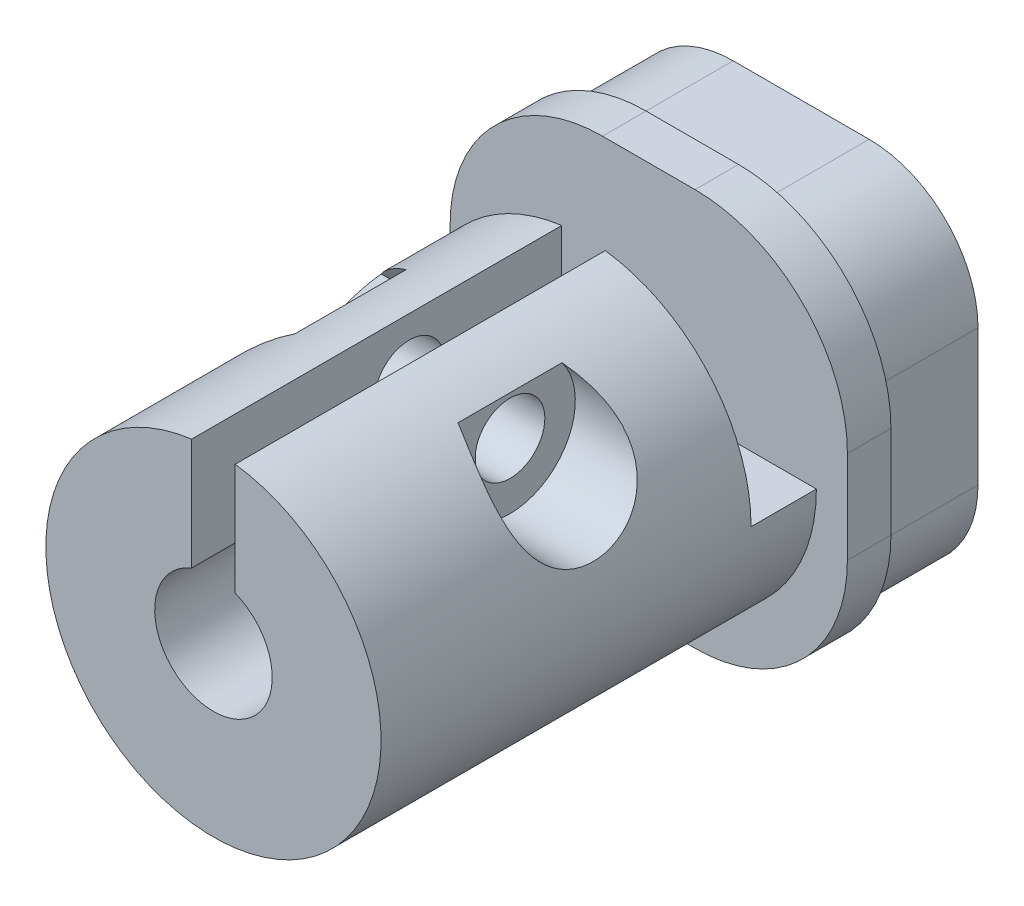
from build123d import *

# Parameters (mm, degrees)
SKETCH1_W               = 16.25
SKETCH1_H               = 16.25
SKETCH1_W_2             = 12.25
SKETCH1_H_2             = 12.25
BOSS_EXTRUDE1_DEPTH     = 5
FILLET1_R               = 5
SKETCH2_W               = 18.25
SKETCH2_H               = 18.25
BOSS_EXTRUDE2_DEPTH     = 2
FILLET2_R               = 7
BOSS_EXTRUDE3_DEPTH     = 20
CUT_EXTRUDE1_DEPTH      = 30.925428151
CUT_EXTRUDE1_DEPTH_BACK = 30.925428151
SKETCH5_R               = 1.6
SKETCH7_R               = 3
CUT_EXTRUDE2_DEPTH      = 5.5
CUT_EXTRUDE3_DEPTH      = 4
SKETCH9_W               = 3
SKETCH9_H               = 10.743898354
CUT_EXTRUDE4_DEPTH      = 34.096015703


with BuildPart() as part:
    # Sketch1 → Boss-Extrude1 (new body)
    with BuildSketch(Plane.XY):
        Rectangle(SKETCH1_W, SKETCH1_H)
        Rectangle(SKETCH1_W_2, SKETCH1_H_2, mode=Mode.SUBTRACT)
    extrude(amount=BOSS_EXTRUDE1_DEPTH)

    # Fillet1
    fillet1_edges = [part.edges().sort_by_distance(p)[0] for p in [
        (6.125, -6.125, 2.5),
        (6.125, 6.125, 2.5),
        (-6.125, 6.125, 2.5),
        (-6.125, -6.125, 2.5),
        (-8.125, 8.125, 2.5),
        (8.125, 8.125, 2.5),
        (8.125, -8.125, 2.5),
        (-8.125, -8.125, 2.5),
    ]]
    fillet(fillet1_edges, radius=FILLET1_R)

    # Sketch2 → Boss-Extrude2 (add)
    with BuildSketch(Plane.XY.offset(5)):
        Rectangle(SKETCH2_W, SKETCH2_H)
    extrude(amount=BOSS_EXTRUDE2_DEPTH)

    # Fillet2
    fillet2_edges = [part.edges().sort_by_distance(p)[0] for p in [
        (-9.125, 9.125, 6),
        (-9.125, -9.125, 6),
        (9.125, -9.125, 6),
        (9.125, 9.125, 6),
    ]]
    fillet(fillet2_edges, radius=FILLET2_R)

    # Sketch3 → Boss-Extrude3 (add)
    with BuildSketch(Plane.XY.offset(7)):
        with BuildLine():
            Line((1, 7.634788799), (1, 2.507987241))
            ThreePointArc((1, 2.507987241), (0, -2.7), (-1, 2.507987241))
            Line((-1, 2.507987241), (-1, 7.634788799))
            ThreePointArc((-1, 7.634788799), (0, -7.7), (1, 7.634788799))
        make_face()
    extrude(amount=BOSS_EXTRUDE3_DEPTH)

    # Sketch5 → Cut-Extrude1 (cut, two sides: drawn at the far end of the back side and taken through both)
    with BuildSketch(Plane(origin=(0, 0, 0), x_dir=(0, 0, -1), z_dir=(1, 0, 0)).offset(-CUT_EXTRUDE1_DEPTH_BACK)):
        with Locations((-17, 4.979474194)):
            Circle(SKETCH5_R)
    extrude(amount=CUT_EXTRUDE1_DEPTH + CUT_EXTRUDE1_DEPTH_BACK, mode=Mode.SUBTRACT)

    # Sketch7 → Cut-Extrude2 (cut)
    with BuildSketch(Plane(origin=(9.125, 0, 0), x_dir=(0, 0, -1), z_dir=(1, 0, 0))):
        with Locations((-17, 4.979474194)):
            Circle(SKETCH7_R)
    extrude(amount=-CUT_EXTRUDE2_DEPTH, mode=Mode.SUBTRACT)

    # Sketch8 → Cut-Extrude3 (cut)
    with BuildSketch(Plane.ZY.offset(7.7)):
        Polygon((13.420428331, 4.979474194), (15.210214166, 1.879474194), (18.789785834, 1.879474194), (20.579571669, 4.979474194), (18.789785834, 8.079474194), (15.210214166, 8.079474194), align=None)
    extrude(amount=-CUT_EXTRUDE3_DEPTH, mode=Mode.SUBTRACT)

    # Sketch9 → Cut-Extrude4 (cut, through all)
    with BuildSketch(Plane.ZY.offset(7.7)):
        with Locations((8.5, 5.371949177)):
            Rectangle(SKETCH9_W, SKETCH9_H)
    extrude(amount=-CUT_EXTRUDE4_DEPTH, mode=Mode.SUBTRACT)


solid = part.part
